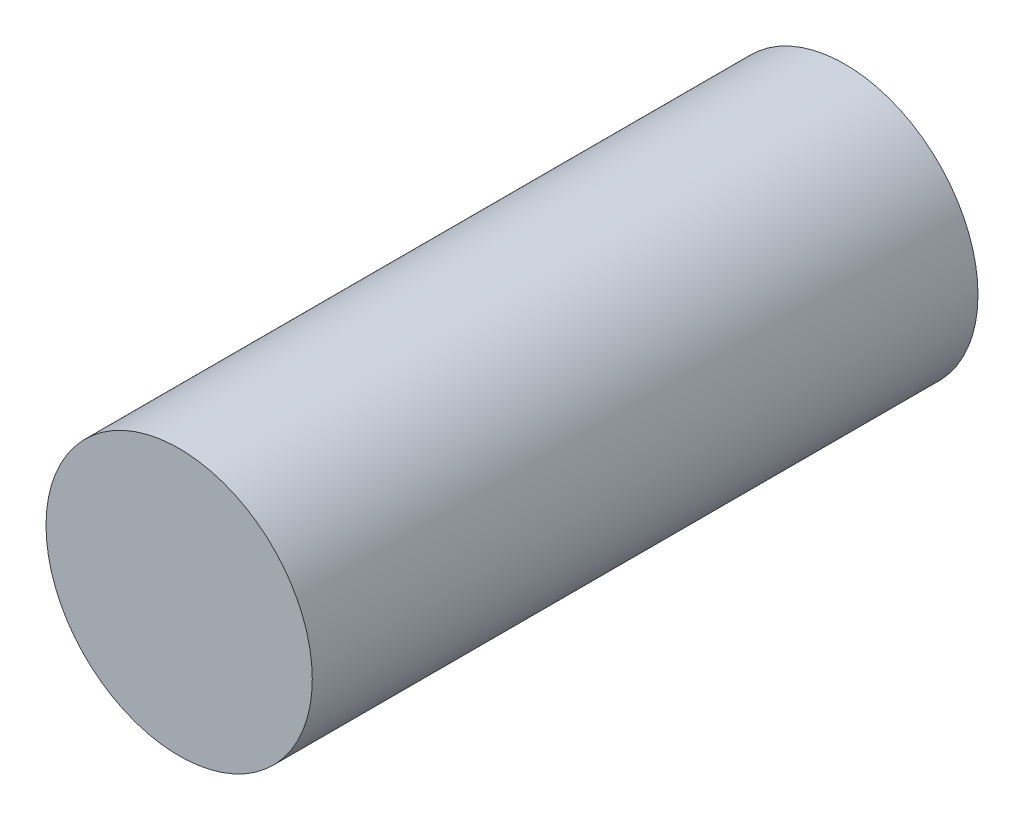
from build123d import *

# Parameters (mm, degrees)
SKETCH1_R           = 4.7625
BOSS_EXTRUDE1_DEPTH = 11.90625


with BuildPart() as part:
    # Sketch1 → Boss-Extrude1 (new, symmetric)
    with BuildSketch(Plane.XY):
        Circle(SKETCH1_R)
    extrude(amount=BOSS_EXTRUDE1_DEPTH, both=True)


solid = part.part
